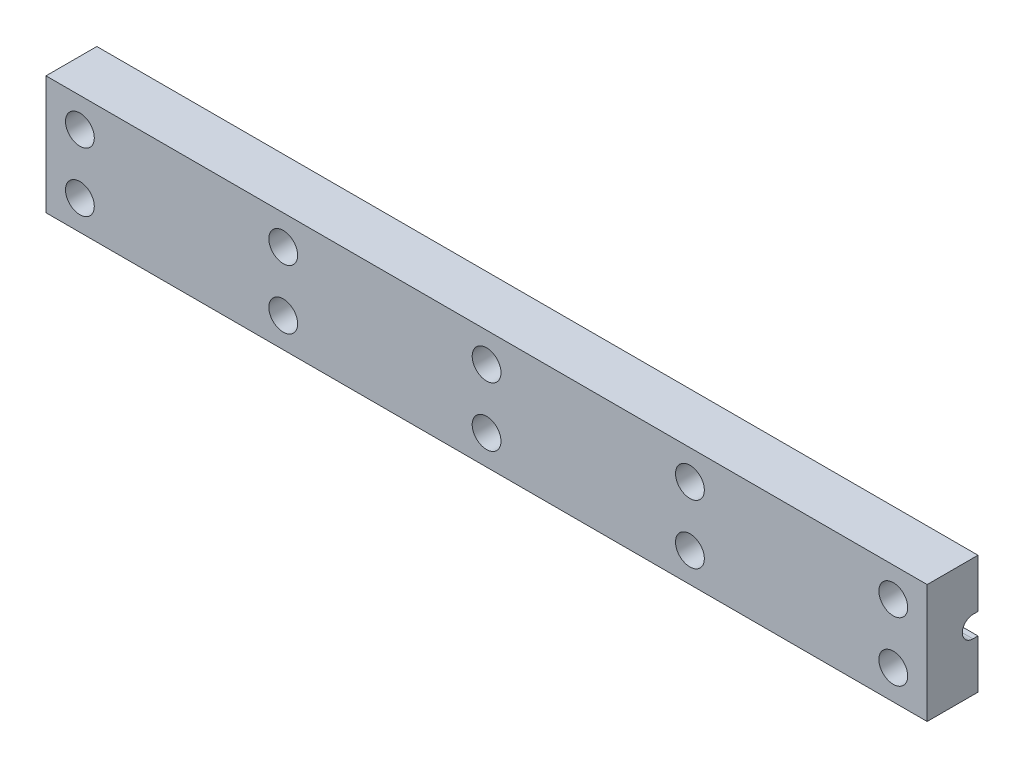
from build123d import *

# Parameters (mm, degrees)
BOSS_EXTRUDE1_DEPTH      = 60
BOSS_EXTRUDE1_DEPTH_BACK = 20
SKETCH2_R                = 1.7
CUT_EXTRUDE1_DEPTH       = 10
BOSS_EXTRUDE2_START      = 24
BOSS_EXTRUDE2_DEPTH      = 24
SKETCH4_R                = 1.7
CUT_EXTRUDE2_DEPTH       = 24


with BuildPart() as part:
    # Sketch1 → Boss-Extrude1 (new, two sides: drawn at the far end of the back side and taken through both)
    with BuildSketch(Plane(origin=(190.645148, 0, 0), x_dir=(0, 0, -1), z_dir=(1, 0, 0)).offset(-BOSS_EXTRUDE1_DEPTH_BACK)):
        with BuildLine():
            Line((-246.970904961, 208.163538159), (-246.970904961, 205.163538159))
            Line((-246.970904961, 205.163538159), (-246.970904961, 197.163538159))
            Line((-246.970904961, 197.163538159), (-246.970904961, 194.163538159))
            Line((-246.970904961, 194.163538159), (-240.970904961, 194.163538159))
            Line((-240.970904961, 194.163538159), (-240.970904961, 197.163538159))
            Line((-240.970904961, 197.163538159), (-240.970904961, 199.913538158))
            Line((-240.970904961, 199.913538158), (-241.570904961, 199.913538158))
            ThreePointArc((-241.570904961, 199.913538158), (-242.820904961, 201.163538162), (-241.570904955, 202.413538158))
            Line((-241.570904955, 202.413538158), (-240.970904961, 202.413538158))
            Line((-240.970904961, 202.413538158), (-240.970904961, 205.163538159))
            Line((-240.970904961, 205.163538159), (-240.970904961, 208.163538159))
            Line((-240.970904961, 208.163538159), (-246.970904961, 208.163538159))
        make_face()
    extrude(amount=BOSS_EXTRUDE1_DEPTH + BOSS_EXTRUDE1_DEPTH_BACK)

    # Sketch2 → Cut-Extrude1 (cut)
    with BuildSketch(Plane.XY.offset(246.970904961)):
        with Locations((246.645148, 197.663538159)):
            Circle(SKETCH2_R)
        with Locations((198.645148, 197.663538159)):
            Circle(SKETCH2_R)
        with Locations((174.645148, 197.663538159)):
            Circle(SKETCH2_R)
        with Locations((222.645148, 197.663538159)):
            Circle(SKETCH2_R)
        with Locations((174.645148, 204.663538159)):
            Circle(SKETCH2_R)
        with Locations(Location((198.645148, 204.663538159, 0), (0, 0, 180))):
            Circle(SKETCH2_R)
        with Locations((222.645148, 204.663538159)):
            Circle(SKETCH2_R)
        with Locations((246.645148, 204.663538159)):
            Circle(SKETCH2_R)
    extrude(amount=-CUT_EXTRUDE1_DEPTH, mode=Mode.SUBTRACT)

    # Sketch3 → Boss-Extrude2 (add)
    with BuildSketch(Plane.ZY.offset(-170.645148).offset(BOSS_EXTRUDE2_START)):
        with BuildLine():
            Line((246.970904961, 208.163538159), (240.970904961, 208.163538159))
            Line((240.970904961, 208.163538159), (240.970904961, 202.413538158))
            Line((240.970904961, 202.413538158), (241.570904955, 202.413538158))
            ThreePointArc((241.570904955, 202.413538158), (242.820904961, 201.163538162), (241.570904961, 199.913538158))
            Line((241.570904961, 199.913538158), (240.970904961, 199.913538158))
            Line((240.970904961, 199.913538158), (240.970904961, 194.163538159))
            Line((240.970904961, 194.163538159), (246.970904961, 194.163538159))
            Line((246.970904961, 194.163538159), (246.970904961, 208.163538159))
        make_face()
    extrude(amount=-BOSS_EXTRUDE2_DEPTH)

    # Sketch4 → Cut-Extrude2 (cut)
    with BuildSketch(Plane.XY.offset(246.970904961)):
        with Locations((150.645148, 197.663538159)):
            Circle(SKETCH4_R)
        with Locations((150.645148, 204.663538159)):
            Circle(SKETCH4_R)
    extrude(amount=-CUT_EXTRUDE2_DEPTH, mode=Mode.SUBTRACT)


solid = part.part
